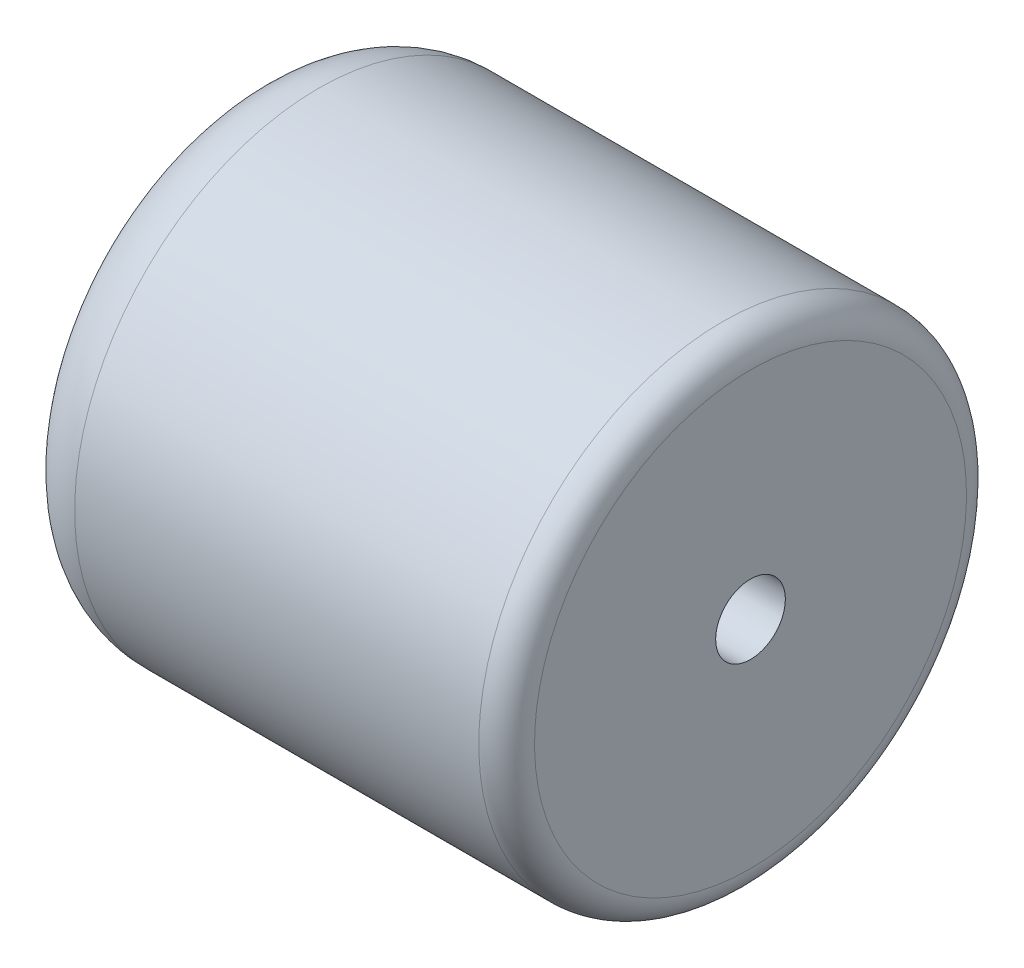
from build123d import *


with BuildPart() as part:
    # Sketch1 → Revolve1 (revolve)
    with BuildSketch(Plane.XY):
        with BuildLine():
            Line((0, 0), (26, 0))
            Line((26, 0), (26, -2.5))
            Line((26, -2.5), (36, -2.5))
            Line((36, -2.5), (36, -15.5))
            ThreePointArc((36, -15.5), (35.414213562, -16.914213562), (34, -17.5))
            Line((34, -17.5), (5, -17.5))
            ThreePointArc((5, -17.5), (1.464466094, -16.035533906), (0, -12.5))
            Line((0, -12.5), (0, 0))
        make_face()
    revolve(axis=Axis((0, 0, 0), (1, 0, 0)))


solid = part.part
